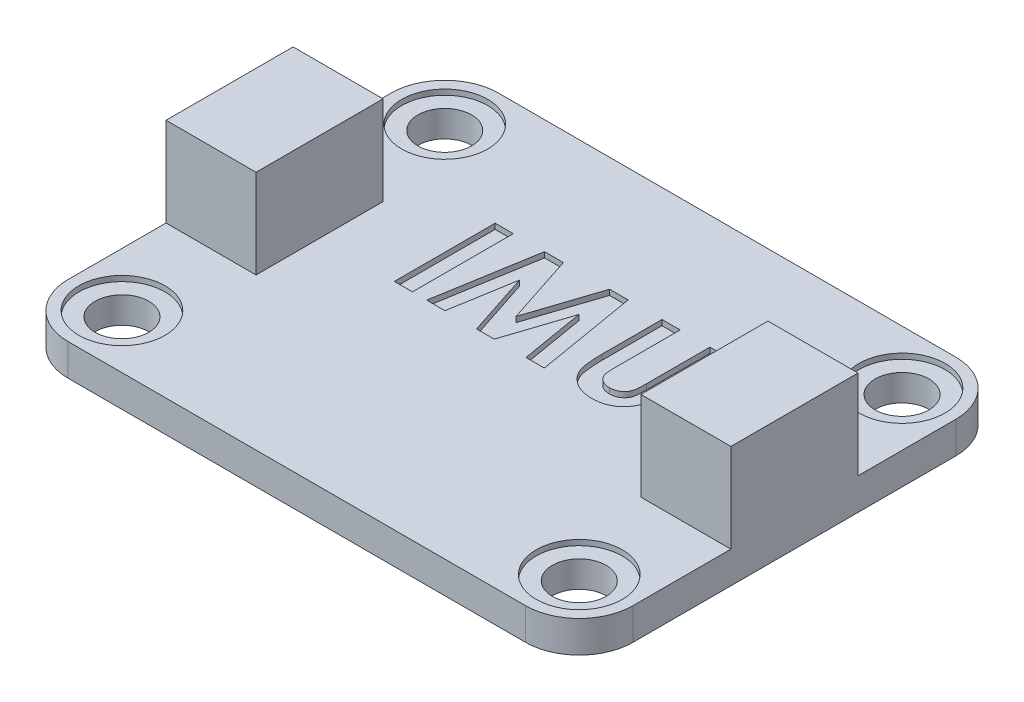
from build123d import *

# Parameters (mm, degrees)
SKETCH1_W           = 26.67
SKETCH1_H           = 20.32
BOSS_EXTRUDE1_DEPTH = 1.5
SKETCH2_R           = 1.27
CUT_EXTRUDE1_DEPTH  = 17.831453443
FILLET1_R           = 2.54
SKETCH3_W           = 0.854807692
SKETCH3_H           = 4.7625
CUT_EXTRUDE2_DEPTH  = 0.254
SKETCH4_R           = 2.032
SKETCH4_R_2         = 1.27
CUT_EXTRUDE3_DEPTH  = 0.254
SKETCH5_W           = 4.25
SKETCH5_H           = 6
BOSS_EXTRUDE3_DEPTH = 4.2


with BuildPart() as part:
    # Sketch1 → Boss-Extrude1 (new body)
    with BuildSketch(Plane(origin=(0, 0, 0), x_dir=(1, 0, 0), z_dir=(0, 1, 0))):
        Rectangle(SKETCH1_W, SKETCH1_H)
    extrude(amount=BOSS_EXTRUDE1_DEPTH)

    # Sketch2 → Cut-Extrude1 (cut, through all)
    with BuildSketch(Plane(origin=(0, 1.5, 0), x_dir=(1, 0, 0), z_dir=(0, 1, 0))):
        with Locations(Location((10.795, 7.62, 0), (0, 0, 270))):
            Circle(SKETCH2_R)
        with Locations(Location((-10.795, 7.62, 0), (0, 0, 270))):
            Circle(SKETCH2_R)
        with Locations(Location((-10.795, -7.62, 0), (0, 0, 270))):
            Circle(SKETCH2_R)
        with Locations(Location((10.795, -7.62, 0), (0, 0, 270))):
            Circle(SKETCH2_R)
    extrude(amount=-CUT_EXTRUDE1_DEPTH, mode=Mode.SUBTRACT)

    # Fillet1
    fillet1_edges = [part.edges().sort_by_distance(p)[0] for p in [
        (13.335, 0.75, 10.16),
        (-13.335, 0.75, 10.16),
        (-13.335, 0.75, -10.16),
        (13.335, 0.75, -10.16),
    ]]
    fillet(fillet1_edges, radius=FILLET1_R)

    # Sketch3 → Cut-Extrude2 (cut)
    with BuildSketch(Plane(origin=(0, 1.5, 0), x_dir=(1, 0, 0), z_dir=(0, 1, 0))):
        with Locations((-5.128846154, 2.38125)):
            Rectangle(SKETCH3_W, SKETCH3_H)
        Polygon((-3.225563401, 4.7625), (-2.33831881, 4.7625), (-1.251682692, 1.440579928), (-0.157414363, 4.7625), (0.72124399, 4.7625), (1.526442308, 0), (0.661140325, 0), (0.152644231, 3.008045373), (-0.837635216, 0), (-1.671454327, 0), (-2.656009615, 3.008045373), (-3.163551683, 0), (-4.029807692, 0), align=None)
        with BuildLine():
            Line((2.320192308, 4.7625), (3.175, 4.7625))
            Line((3.175, 4.7625), (3.175, 1.663822115))
            add(Edge.make_bspline(
                [(3.175, 1.663822115), (3.17504648, 1.631696367), (3.175136256, 1.569645816), (3.179630493, 1.480623591), (3.18374303, 1.398793527), (3.191163214, 1.32424521), (3.202125369, 1.256946752), (3.212740313, 1.19646585), (3.227106588, 1.143885348), (3.248696804, 1.08403497), (3.281960239, 1.016789802), (3.336310846, 0.946705344), (3.399026797, 0.882743105), (3.474195476, 0.82950336), (3.558678424, 0.786437205), (3.652011444, 0.75452995), (3.75406297, 0.736793753), (3.824626003, 0.734085998), (3.860945012, 0.732692308)],
                knots=[0, 0, 0, 0, 1.155499968, 2.231836252, 3.205919964, 4.102923608, 4.924856345, 5.658536265, 6.31071849, 6.882491295, 7.94666036, 8.992281882, 10.060072772, 11.158554251, 12.289267114, 13.461410017, 14.693379945, 16, 16, 16, 16], degree=3))
            add(Edge.make_bspline(
                [(3.860945012, 0.732692308), (3.899529477, 0.73381823), (3.974762653, 0.736013589), (4.082973598, 0.757563409), (4.183231653, 0.791878102), (4.273414012, 0.840853915), (4.353430929, 0.89956001), (4.421163572, 0.966503355), (4.474617926, 1.041817469), (4.509457485, 1.111300474), (4.529018182, 1.17525353), (4.543679898, 1.232393158), (4.554428558, 1.299812263), (4.564180096, 1.376457951), (4.570040019, 1.463124123), (4.57639415, 1.559113798), (4.578722998, 1.665083764), (4.579119934, 1.73887264), (4.579326923, 1.777351262)],
                knots=[0, 0, 0, 0, 1.261321664, 2.459363699, 3.594844139, 4.716940403, 5.803436589, 6.833651888, 7.818396249, 8.814403945, 9.360733334, 10.004355033, 10.743453831, 11.592799886, 12.532235708, 13.585170094, 14.740740724, 16, 16, 16, 16], degree=3))
            Line((4.579326923, 1.777351262), (4.579326923, 4.7625))
            Line((4.579326923, 4.7625), (5.434134615, 4.7625))
            Line((5.434134615, 4.7625), (5.434134615, 1.921409255))
            add(Edge.make_bspline(
                [(5.434134615, 1.921409255), (5.43401591, 1.863848892), (5.433787651, 1.753165928), (5.430282276, 1.59410672), (5.422819969, 1.448831648), (5.416552491, 1.317298262), (5.404422776, 1.199683761), (5.391786458, 1.095485896), (5.375680384, 1.00507392), (5.351715514, 0.902150874), (5.310359243, 0.783638756), (5.243687513, 0.647177189), (5.159052066, 0.513573049), (5.059017198, 0.384296074), (4.946068681, 0.26420193), (4.822710827, 0.158774817), (4.690903483, 0.069594847), (4.549269359, -0.00115742), (4.397928993, -0.056338855), (4.235384983, -0.093418), (4.061748173, -0.118469136), (3.941813946, -0.120875606), (3.880025541, -0.122115385)],
                knots=[0, 0, 0, 0, 1.170808336, 2.251350247, 3.235597562, 4.129743112, 4.929140599, 5.639994148, 6.264258765, 6.79612947, 7.788252245, 8.809469599, 9.879094798, 10.999557536, 12.129761673, 13.226370002, 14.293821979, 15.358369427, 16.438775801, 17.562147481, 18.744053101, 20, 20, 20, 20], degree=3))
            add(Edge.make_bspline(
                [(3.880025541, -0.122115385), (3.838972095, -0.121423894), (3.757974489, -0.120059596), (3.638853299, -0.108030054), (3.523699269, -0.090303032), (3.412728772, -0.064441133), (3.305556652, -0.031032389), (3.20221138, 0.010091447), (3.103077013, 0.058700993), (3.008708293, 0.114349146), (2.919221348, 0.174523044), (2.8374349, 0.241228342), (2.760534484, 0.309531933), (2.690741722, 0.382308322), (2.627532409, 0.458793479), (2.571036723, 0.539160746), (2.521338598, 0.623402985), (2.477187905, 0.713038656), (2.439399222, 0.812623617), (2.407541942, 0.925700146), (2.379710672, 1.054040605), (2.359028115, 1.197934139), (2.340277187, 1.356906489), (2.328408884, 1.531371804), (2.32220004, 1.721335089), (2.320878462, 1.853032696), (2.320192308, 1.921409255)],
                knots=[0, 0, 0, 0, 1.001158378, 1.975264943, 2.917723546, 3.841610987, 4.75185031, 5.653588123, 6.552117133, 7.442167995, 8.324307438, 9.179605724, 10.014504199, 10.831958861, 11.636465792, 12.43274043, 13.225645099, 14.020104002, 14.867201867, 15.819789774, 16.883317127, 18.068162734, 19.364263498, 20.787406516, 22.332041935, 24, 24, 24, 24], degree=3))
            Line((2.320192308, 1.921409255), (2.320192308, 4.7625))
        make_face()
    extrude(amount=-CUT_EXTRUDE2_DEPTH, mode=Mode.SUBTRACT)

    # Sketch4 → Cut-Extrude3 (cut)
    # profile 1 of 4: a face of its own
    with BuildSketch(Plane(origin=(0, 1.5, 0), x_dir=(1, 0, 0), z_dir=(0, 1, 0))):
        with Locations(Location((-10.795, 7.62, 0), (0, 0, 270))):
            Circle(SKETCH4_R)
        with Locations(Location((-10.795, 7.62, 0), (0, 0, 270))):
            Circle(SKETCH4_R_2, mode=Mode.SUBTRACT)
    # profile 2 of 4: a face of its own
    with BuildSketch(Plane(origin=(0, 1.5, 0), x_dir=(1, 0, 0), z_dir=(0, 1, 0))):
        with Locations(Location((10.795, 7.62, 0), (0, 0, 270))):
            Circle(SKETCH4_R)
        with Locations(Location((10.795, 7.62, 0), (0, 0, 270))):
            Circle(SKETCH4_R_2, mode=Mode.SUBTRACT)
    # profile 3 of 4: a face of its own
    with BuildSketch(Plane(origin=(0, 1.5, 0), x_dir=(1, 0, 0), z_dir=(0, 1, 0))):
        with Locations(Location((10.795, -7.62, 0), (0, 0, 270))):
            Circle(SKETCH4_R)
        with Locations(Location((10.795, -7.62, 0), (0, 0, 270))):
            Circle(SKETCH4_R_2, mode=Mode.SUBTRACT)
    # profile 4 of 4: a face of its own
    with BuildSketch(Plane(origin=(0, 1.5, 0), x_dir=(1, 0, 0), z_dir=(0, 1, 0))):
        with Locations(Location((-10.795, -7.62, 0), (0, 0, 270))):
            Circle(SKETCH4_R)
        with Locations(Location((-10.795, -7.62, 0), (0, 0, 270))):
            Circle(SKETCH4_R_2, mode=Mode.SUBTRACT)
    extrude(amount=-CUT_EXTRUDE3_DEPTH, mode=Mode.SUBTRACT)

    # Sketch5 → Boss-Extrude3 (add)
    with BuildSketch(Plane(origin=(0, 1.5, 0), x_dir=(1, 0, 0), z_dir=(0, 1, 0))):
        with Locations((-11.21, 0)):
            Rectangle(SKETCH5_W, SKETCH5_H)
        with Locations((11.21, 0)):
            Rectangle(SKETCH5_W, SKETCH5_H)
    extrude(amount=BOSS_EXTRUDE3_DEPTH)


solid = part.part
